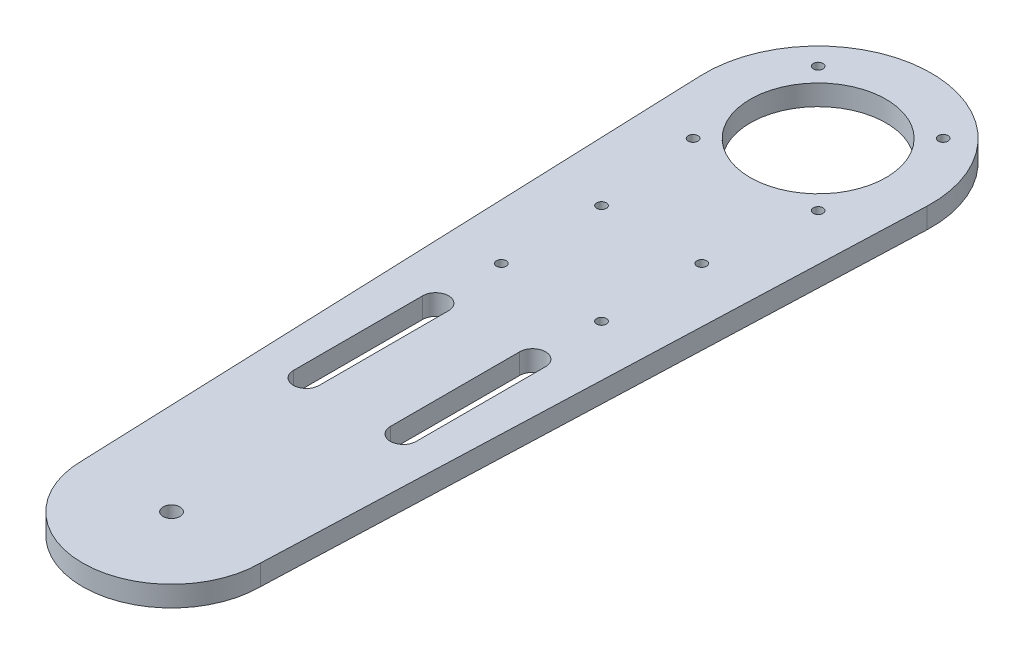
from build123d import *

# Parameters (mm, degrees)
BOSS_EXTRUDE1_DEPTH     = 6.35
SKETCH2_R               = 2.6
CUT_EXTRUDE1_DEPTH      = 238.676928834
ESQUISSE3_R             = 21
ENL_V_MAT_EXTRU_2_DEPTH = 238.676928834
ESQUISSE7_R             = 1.5
ENL_V_MAT_EXTRU_3_DEPTH = 238.676928834
CUT_EXTRUDE3_DEPTH      = 238.676928834
SKETCH5_R               = 1.5
CUT_EXTRUDE4_DEPTH      = 238.676928834


with BuildPart() as part:
    # Sketch1 → Boss-Extrude1 (new body)
    with BuildSketch(Plane(origin=(0, 0, 0), x_dir=(1, 0, 0), z_dir=(0, 1, 0))):
        with BuildLine():
            Line((27.5, 0), (34.975254116, 198.684097441))
            ThreePointArc((34.975254116, 198.684097441), (0, 235), (-34.975254116, 198.684097441))
            Line((-34.975254116, 198.684097441), (-27.5, 0))
            ThreePointArc((-27.5, 0), (0, -27.5), (27.5, 0))
        make_face()
    extrude(amount=BOSS_EXTRUDE1_DEPTH)

    # Sketch2 → Cut-Extrude1 (cut, through all)
    with BuildSketch(Plane(origin=(0, 6.35, 0), x_dir=(1, 0, 0), z_dir=(0, 1, 0))):
        with Locations(Location((0, 0, 0), (0, 0, 270))):
            Circle(SKETCH2_R)
    extrude(amount=-CUT_EXTRUDE1_DEPTH, mode=Mode.SUBTRACT)

    # Esquisse3 → Enlèv. mat.-Extru.2 (cut, through all)
    with BuildSketch(Plane(origin=(0, 6.35, 0), x_dir=(1, 0, 0), z_dir=(0, 1, 0))):
        with Locations(Location((0, 200, 0), (0, 0, 270))):
            Circle(ESQUISSE3_R)
    extrude(amount=-ENL_V_MAT_EXTRU_2_DEPTH, mode=Mode.SUBTRACT)

    # Esquisse7 → Enlèv. mat.-Extru.3 (cut, through all)
    with BuildSketch(Plane(origin=(0, 6.35, 0), x_dir=(1, 0, 0), z_dir=(0, 1, 0))):
        with Locations(Location((-19.339370465, 219.339370465, 0), (0, 0, 270))):
            Circle(ESQUISSE7_R)
        with Locations(Location((19.339370465, 219.339370465, 0), (0, 0, 270))):
            Circle(ESQUISSE7_R)
        with Locations(Location((19.339370465, 180.660629535, 0), (0, 0, 270))):
            Circle(ESQUISSE7_R)
        with Locations(Location((-19.339370465, 180.660629535, 0), (0, 0, 270))):
            Circle(ESQUISSE7_R)
    extrude(amount=-ENL_V_MAT_EXTRU_3_DEPTH, mode=Mode.SUBTRACT)

    # Sketch4 → Cut-Extrude3 (cut, through all)
    with BuildSketch(Plane(origin=(0, 6.35, 0), x_dir=(1, 0, 0), z_dir=(0, 1, 0))):
        with BuildLine():
            Line((-19, 56.7), (-19, 96.7))
            ThreePointArc((-19, 96.7), (-15, 100.7), (-11, 96.7))
            Line((-11, 96.7), (-11, 56.7))
            ThreePointArc((-11, 56.7), (-15, 52.7), (-19, 56.7))
        make_face()
        with BuildLine():
            Line((11, 56.7), (11, 96.7))
            ThreePointArc((11, 96.7), (15, 100.7), (19, 96.7))
            Line((19, 96.7), (19, 56.7))
            ThreePointArc((19, 56.7), (15, 52.7), (11, 56.7))
        make_face()
    extrude(amount=-CUT_EXTRUDE3_DEPTH, mode=Mode.SUBTRACT)

    # Sketch5 → Cut-Extrude4 (cut, through all)
    with BuildSketch(Plane.XZ):
        with Locations(Location((15.5, -117.5, 0), (0, 0, 270))):
            Circle(SKETCH5_R)
        with Locations(Location((15.5, -148.5, 0), (0, 0, 270))):
            Circle(SKETCH5_R)
        with Locations(Location((-15.5, -148.5, 0), (0, 0, 270))):
            Circle(SKETCH5_R)
        with Locations(Location((-15.5, -117.5, 0), (0, 0, 270))):
            Circle(SKETCH5_R)
    extrude(amount=-CUT_EXTRUDE4_DEPTH, mode=Mode.SUBTRACT)


solid = part.part
